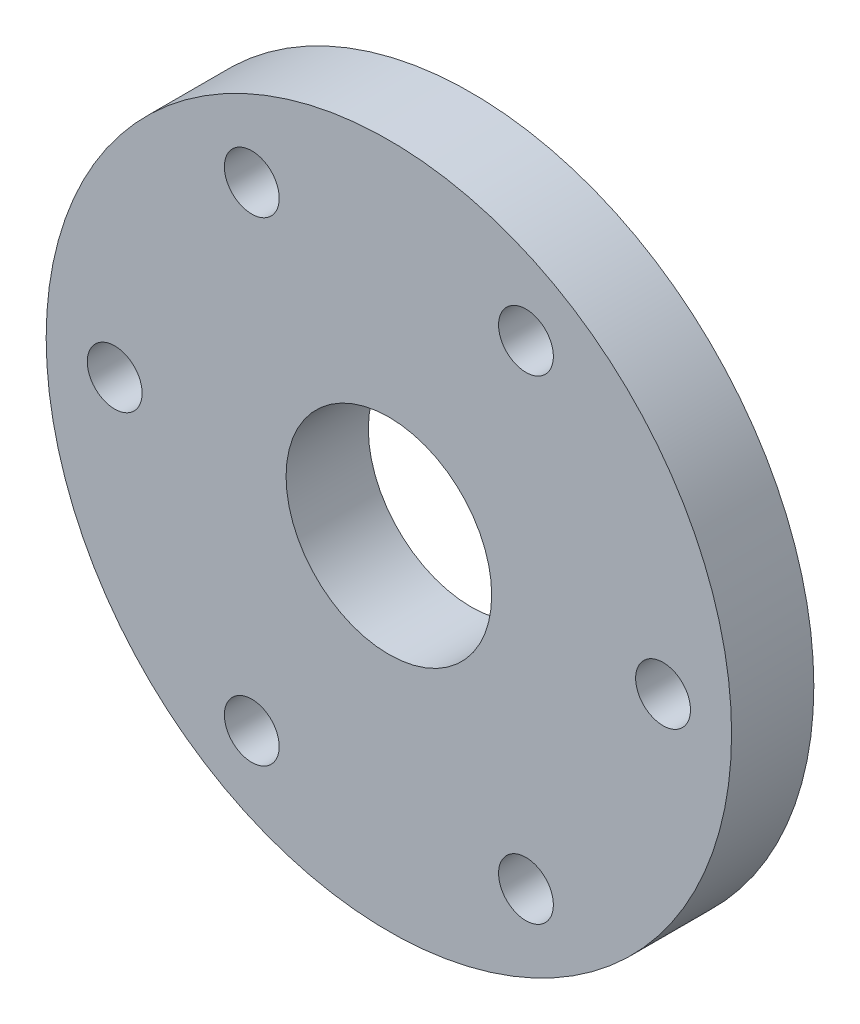
from build123d import *

# Parameters (mm, degrees)
SKETCH_1_R          = 50
SKETCH_1_R_2        = 15
EXTRUDE_1_DEPTH     = 12
SKETCH_2_R          = 4
CUT_EXTRUDE_1_DEPTH = 72.721684308


with BuildPart() as part:
    # 草图1 → 凸台-拉伸1 (new body)
    with BuildSketch(Plane.XY):
        Circle(SKETCH_1_R)
        Circle(SKETCH_1_R_2, mode=Mode.SUBTRACT)
    extrude(amount=EXTRUDE_1_DEPTH)

    # 草图2 → 切除-拉伸1 (cut, through all)
    with BuildSketch(Plane.XY):
        with Locations((40, 0)):
            Circle(SKETCH_2_R)
        with Locations((20, 34.641016)):
            Circle(SKETCH_2_R)
        with Locations((-20, 34.641016)):
            Circle(SKETCH_2_R)
        with Locations((-40, 0)):
            Circle(SKETCH_2_R)
        with Locations((-20, -34.641016)):
            Circle(SKETCH_2_R)
        with Locations((20, -34.641016)):
            Circle(SKETCH_2_R)
    extrude(amount=CUT_EXTRUDE_1_DEPTH, mode=Mode.SUBTRACT)


solid = part.part
